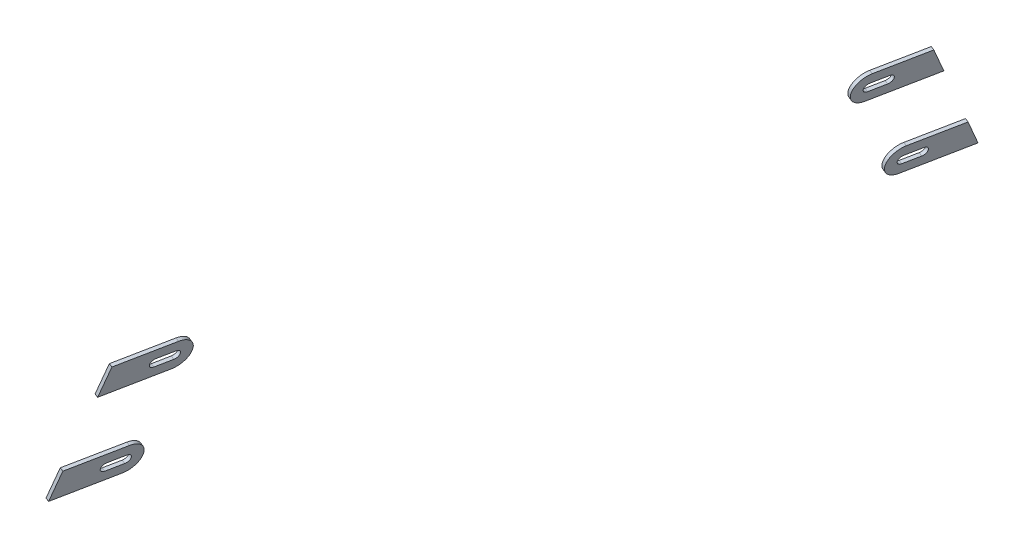
from build123d import *

# Parameters (mm, degrees)
BOSS_EXTRUDE1_DEPTH = 2
BOSS_EXTRUDE2_DEPTH = 2
BOSS_EXTRUDE3_DEPTH = 2
BOSS_EXTRUDE4_DEPTH = 2


with BuildPart() as part:
    # Sketch2 → Boss-Extrude1 (new body)
    with BuildSketch(Plane(origin=(-659.614198676, 210.630673215, -131.193827815), x_dir=(-0.17733557040624798, 0.05662751143705045, 0.9825199338523047), z_dir=(-0.9359591821601213, 0.2988742708017777, -0.18615740539356104))):
        with BuildLine():
            Line((-1764.030614284, 441.269797966), (-1724.820439918, 438.938964058))
            ThreePointArc((-1724.820439918, 438.938964058), (-1715.302240563, 447.389045775), (-1723.75232228, 456.90724513))
            Line((-1723.75232228, 456.90724513), (-1754.41879653, 458.730202034))
            Line((-1754.41879653, 458.730202034), (-1764.030614284, 441.269797966))
        make_face()
        with BuildLine():
            Line((-1734.105574834, 451.261657334), (-1724.12319646, 450.668258647))
            ThreePointArc((-1724.12319646, 450.668258647), (-1721.541227046, 447.759919955), (-1724.449565738, 445.177950541))
            Line((-1724.449565738, 445.177950541), (-1734.431944112, 445.771349229))
            ThreePointArc((-1734.431944112, 445.771349229), (-1737.013913526, 448.67968792), (-1734.105574834, 451.261657334))
        make_face(mode=Mode.SUBTRACT)
    extrude(amount=BOSS_EXTRUDE1_DEPTH)


with BuildPart() as body_2:
    # Sketch4 → Boss-Extrude2 (new body)
    with BuildSketch(Plane(origin=(-659.614198676, 210.630673215, -131.193827815), x_dir=(-0.17733557040624798, 0.05662751143705045, 0.9825199338523047), z_dir=(-0.9359591821601213, 0.2988742708017777, -0.18615740539356104))):
        with BuildLine():
            Line((-1787.448333705, 398.730202034), (-1756.720183763, 396.903578842))
            ThreePointArc((-1756.720183763, 396.903578842), (-1748.270102045, 387.385379487), (-1757.7883014, 378.93529777))
            Line((-1757.7883014, 378.93529777), (-1797.060151459, 381.269797966))
            Line((-1797.060151459, 381.269797966), (-1787.448333705, 398.730202034))
        make_face()
        with BuildLine():
            Line((-1767.073436317, 391.257991046), (-1757.091057943, 390.664592359))
            ThreePointArc((-1757.091057943, 390.664592359), (-1754.509088529, 387.756253667), (-1757.417427221, 385.174284253))
            Line((-1757.417427221, 385.174284253), (-1767.399805595, 385.767682941))
            ThreePointArc((-1767.399805595, 385.767682941), (-1769.981775008, 388.676021632), (-1767.073436317, 391.257991046))
        make_face(mode=Mode.SUBTRACT)
    extrude(amount=BOSS_EXTRUDE2_DEPTH)


with BuildPart() as body_3:
    # Sketch5 → Boss-Extrude3 (new body)
    with BuildSketch(Plane(origin=(-659.614198676, 210.630673215, -131.193827815), x_dir=(-0.17733557040624798, 0.05662751143705045, 0.9825199338523047), z_dir=(-0.9359591821601213, 0.2988742708017777, -0.18615740539356104))):
        with BuildLine():
            Line((-1345.002932348, 434.392631635), (-1342.546336954, 416.214825336))
            Line((-1342.546336954, 416.214825336), (-1379.247017778, 418.396483355))
            ThreePointArc((-1379.247017778, 418.396483355), (-1387.697099496, 427.91468271), (-1378.178900141, 436.364764428))
            Line((-1378.178900141, 436.364764428), (-1345.002932348, 434.392631635))
        make_face()
        with BuildLine():
            Line((-1378.54977432, 430.125777944), (-1368.567395947, 429.532379257))
            ThreePointArc((-1368.567395947, 429.532379257), (-1365.985426533, 426.624040565), (-1368.893765225, 424.042071151))
            Line((-1368.893765225, 424.042071151), (-1378.876143599, 424.635469839))
            ThreePointArc((-1378.876143599, 424.635469839), (-1381.458113012, 427.543808531), (-1378.54977432, 430.125777944))
        make_face(mode=Mode.SUBTRACT)
    extrude(amount=BOSS_EXTRUDE3_DEPTH)


with BuildPart() as body_4:
    # Sketch6 → Boss-Extrude4 (new body)
    with BuildSketch(Plane(origin=(-659.614198676, 210.630673215, -131.193827815), x_dir=(-0.17733557040624798, 0.05662751143705045, 0.9825199338523047), z_dir=(-0.9359591821601213, 0.2988742708017777, -0.18615740539356104))):
        with BuildLine():
            Line((-1336.561219138, 371.927388922), (-1334.104623744, 353.749582623))
            Line((-1334.104623744, 353.749582623), (-1370.805304568, 355.931240642))
            ThreePointArc((-1370.805304568, 355.931240642), (-1379.255386286, 365.449439997), (-1369.737186931, 373.899521715))
            Line((-1369.737186931, 373.899521715), (-1336.561219138, 371.927388922))
        make_face()
        with BuildLine():
            Line((-1370.10806111, 367.660535231), (-1360.125682737, 367.067136544))
            ThreePointArc((-1360.125682737, 367.067136544), (-1357.543713323, 364.158797852), (-1360.452052015, 361.576828438))
            Line((-1360.452052015, 361.576828438), (-1370.434430388, 362.170227126))
            ThreePointArc((-1370.434430388, 362.170227126), (-1373.016399802, 365.078565818), (-1370.10806111, 367.660535231))
        make_face(mode=Mode.SUBTRACT)
    extrude(amount=BOSS_EXTRUDE4_DEPTH)


solid = Compound([part.part, body_2.part, body_3.part, body_4.part])
